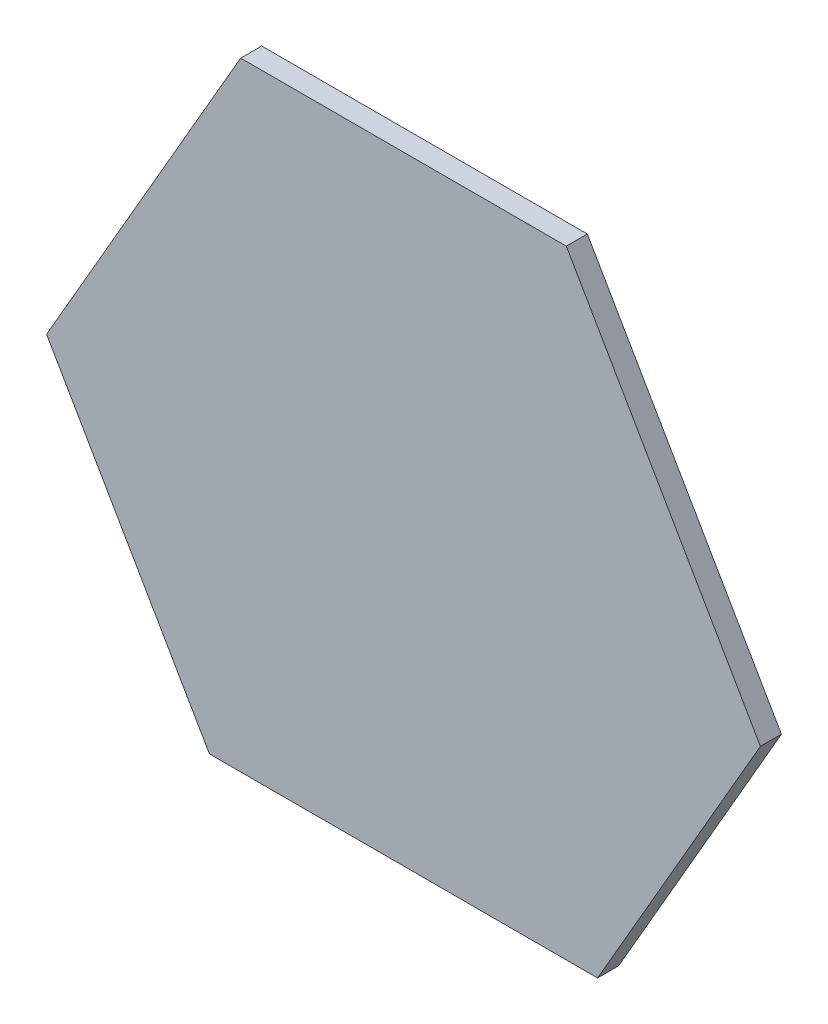
from build123d import *

# Parameters (mm, degrees)
BOSS_EXTRUDE1_DEPTH = 6.35


with BuildPart() as part:
    # Sketch1 → Boss-Extrude1 (new body)
    with BuildSketch(Plane.XY):
        Polygon((-49.2125, 96.146183456), (49.2125, 96.146183456), (107.87128735, -5.453816544), (58.65878735, -90.692366912), (-58.65878735, -90.692366912), (-107.87128735, -5.453816544), align=None)
    extrude(amount=BOSS_EXTRUDE1_DEPTH)


solid = part.part
